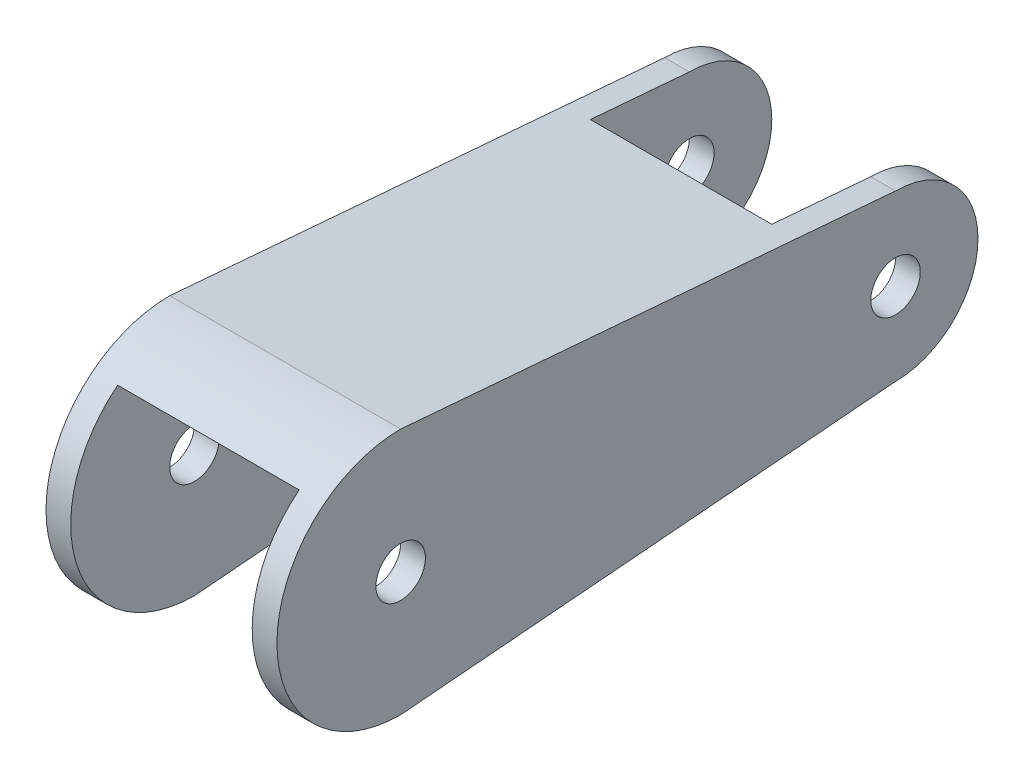
from build123d import *

# Parameters (mm, degrees)
BOSS_EXTRUDE1_DEPTH     = 70
CUT_EXTRUDE1_DEPTH      = 193.17505041
CUT_EXTRUDE1_DEPTH_BACK = 193.17505041
SKETCH2_W               = 55
SKETCH2_H               = 55
CUT_EXTRUDE2_REACH      = 212.087
CUT_EXTRUDE2_START      = -10
SKETCH4_W               = 55
SKETCH4_H               = 159.369241685
SKETCH7_R               = 7.5
CUT_EXTRUDE4_DEPTH      = 193.17505041
SKETCH8_R               = 7.5
CUT_EXTRUDE5_DEPTH      = 193.17505041


with BuildPart() as part:
    # Sketch1 → Boss-Extrude1 (new body)
    with BuildSketch(Plane(origin=(0, 0, 0), x_dir=(0, 0, -1), z_dir=(1, 0, 0))):
        with BuildLine():
            Line((0, 37.5), (150, 25))
            ThreePointArc((150, 25), (175, 0), (150, -25))
            Line((150, -25), (0, -37.5))
            ThreePointArc((0, -37.5), (-37.5, 0), (0, 37.5))
        make_face()
    extrude(amount=BOSS_EXTRUDE1_DEPTH)

    # Sketch2 → Cut-Extrude1 (cut, two sides: drawn at the far end of the back side and taken through both)
    with BuildSketch(Plane(origin=(0, 0, 0), x_dir=(1, 0, 0), z_dir=(0, 1, 0)).offset(-CUT_EXTRUDE1_DEPTH_BACK)):
        with Locations((35, 147.5)):
            Rectangle(SKETCH2_W, SKETCH2_H)
    extrude(amount=CUT_EXTRUDE1_DEPTH + CUT_EXTRUDE1_DEPTH_BACK, mode=Mode.SUBTRACT)

    # Cut-Extrude2: up to this face of the body (flat: up to its plane)
    cut_extrude2_end = Plane(part.part.faces().sort_by_distance((35, -32.18220339, -63.813559322))[0])
    # Sketch4 → Cut-Extrude2 (cut, up to the picked face)
    with BuildSketch(Plane(origin=(0, 37.24137931, -3.103448276), x_dir=(1, 0, 0), z_dir=(0, 0.9965457582448797, -0.08304547985374003)).offset(CUT_EXTRUDE2_START), mode=Mode.PRIVATE) as cut_extrude2_sk1:
        with Locations((35, 42.184620843)):
            Rectangle(SKETCH4_W, SKETCH4_H)
    cut_extrude2_tool1 = split(extrude(cut_extrude2_sk1.sketch, amount=-CUT_EXTRUDE2_REACH, mode=Mode.PRIVATE), bisect_by=cut_extrude2_end, keep=Keep.BOTH, mode=Mode.PRIVATE)
    add(cut_extrude2_tool1.solids().sort_by(Axis((35, 23.77268, -44.311898), (0, -0.9965457582448797, 0.08304547985374003)))[0], mode=Mode.SUBTRACT)

    # Sketch7 → Cut-Extrude4 (cut, through all)
    with BuildSketch(Plane(origin=(70, 0, 0), x_dir=(0, 0, -1), z_dir=(1, 0, 0))):
        Circle(SKETCH7_R)
    extrude(amount=-CUT_EXTRUDE4_DEPTH, mode=Mode.SUBTRACT)

    # Sketch8 → Cut-Extrude5 (cut, through all)
    with BuildSketch(Plane(origin=(70, 0, 0), x_dir=(0, 0, -1), z_dir=(1, 0, 0))):
        with Locations((150, 0)):
            Circle(SKETCH8_R)
    extrude(amount=-CUT_EXTRUDE5_DEPTH, mode=Mode.SUBTRACT)


solid = part.part
